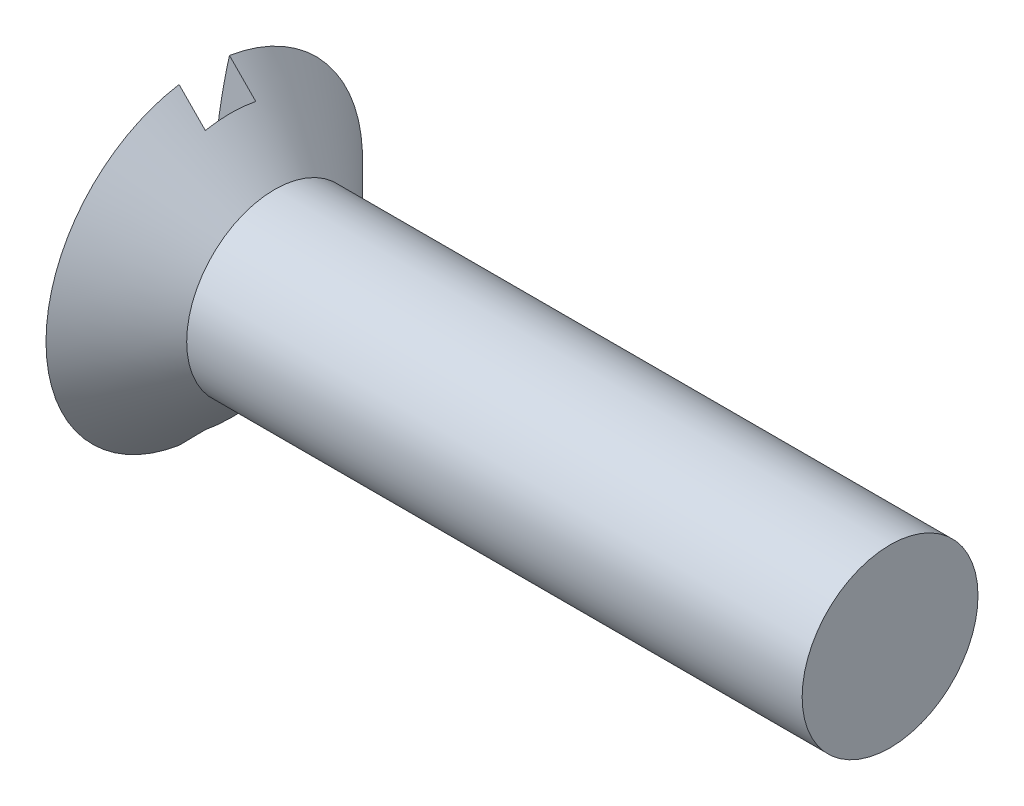
from build123d import *

# Parameters (mm, degrees)
SKETCH2_W          = 1.583951874
SKETCH2_H          = 0.909262002
CUT_EXTRUDE1_DEPTH = 4.064


with BuildPart() as part:
    # Sketch1 → Revolve1 (revolve)
    with BuildSketch(Plane.XY, mode=Mode.PRIVATE) as revolve1_sk:
        with BuildLine():
            Line((0, 0), (12.7, 0))
            Line((12.7, 0), (12.7, 1.5875))
            Line((12.7, 1.5875), (1.5875, 1.5875))
            Line((1.5875, 1.5875), (0.3175, 2.8575))
            ThreePointArc((0.3175, 2.8575), (0.079618484, 1.437542391), (0, 0))
        make_face()
    revolve(revolve1_sk.sketch.rotate(Axis((0, 0, 0), (1, 0, 0)), 90), axis=Axis((0, 0, 0), (1, 0, 0)))

    # Sketch2 → Cut-Extrude1 (cut, symmetric)
    with BuildSketch(Plane(origin=(0, 0, 0), x_dir=(1, 0, 0), z_dir=(0, 1, 0))):
        Rectangle(SKETCH2_W, SKETCH2_H)
    extrude(amount=CUT_EXTRUDE1_DEPTH, both=True, mode=Mode.SUBTRACT)


solid = part.part
